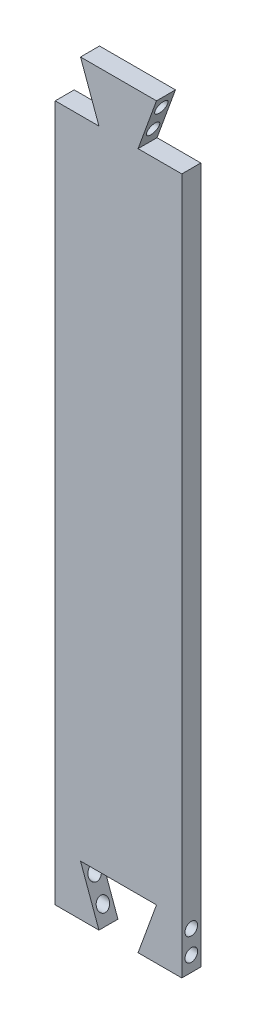
from build123d import *

# Parameters (mm, degrees)
SKETCH1_W               = 50
SKETCH1_H               = 275
BOSS_EXTRUDE1_DEPTH     = 7.5
BOSS_EXTRUDE2_DEPTH     = 7.5
SKETCH3_R               = 2.5
CUT_EXTRUDE1_DEPTH      = 280.609102141
CUT_EXTRUDE2_REACH      = 281.609
CUT_EXTRUDE3_DEPTH      = 280.609102141
CUT_EXTRUDE3_DEPTH_BACK = 280.609102141
SKETCH5_R               = 2.5


with BuildPart() as part:
    # Sketch1 → Boss-Extrude1 (new body)
    with BuildSketch(Plane.XY):
        with Locations((25, -137.5)):
            Rectangle(SKETCH1_W, SKETCH1_H)
    extrude(amount=BOSS_EXTRUDE1_DEPTH)

    # Sketch2 → Boss-Extrude2 (add)
    with BuildSketch(Plane.XY.offset(7.5)):
        Polygon((17.279404685, 0), (10, 20), (40, 20), (32.720595315, 0), align=None)
    extrude(amount=-BOSS_EXTRUDE2_DEPTH)

    # Sketch3 → Cut-Extrude1 (cut, through all)
    with BuildSketch(Plane.ZY):
        with Locations(Location((3.75, 15, 0), (0, 0, 270))):
            Circle(SKETCH3_R)
        with Locations(Location((3.75, 6, 0), (0, 0, 270))):
            Circle(SKETCH3_R)
    extrude(amount=-CUT_EXTRUDE1_DEPTH, mode=Mode.SUBTRACT)

    # Sketch4 → Cut-Extrude2 (cut, up to next)
    with BuildSketch(Plane.XY.offset(7.5), mode=Mode.PRIVATE) as cut_extrude2_sk1:
        Polygon((17.279404685, -275), (10, -255), (40, -255), (32.720595315, -275), align=None)
    cut_extrude2_tool1 = extrude(cut_extrude2_sk1.sketch, amount=-CUT_EXTRUDE2_REACH, mode=Mode.PRIVATE) & part.part
    add(cut_extrude2_tool1.solids().sort_by_distance((25, -263.93204, 7.5))[0], mode=Mode.SUBTRACT)

    # Sketch5 → Cut-Extrude3 (cut, two sides: drawn at the far end of the back side and taken through both)
    with BuildSketch(Plane.ZY.offset(-CUT_EXTRUDE3_DEPTH_BACK)):
        with Locations(Location((3.75, -269, 0), (0, 0, 270))):
            Circle(SKETCH5_R)
        with Locations(Location((3.75, -260, 0), (0, 0, 270))):
            Circle(SKETCH5_R)
    extrude(amount=CUT_EXTRUDE3_DEPTH + CUT_EXTRUDE3_DEPTH_BACK, mode=Mode.SUBTRACT)


solid = part.part
